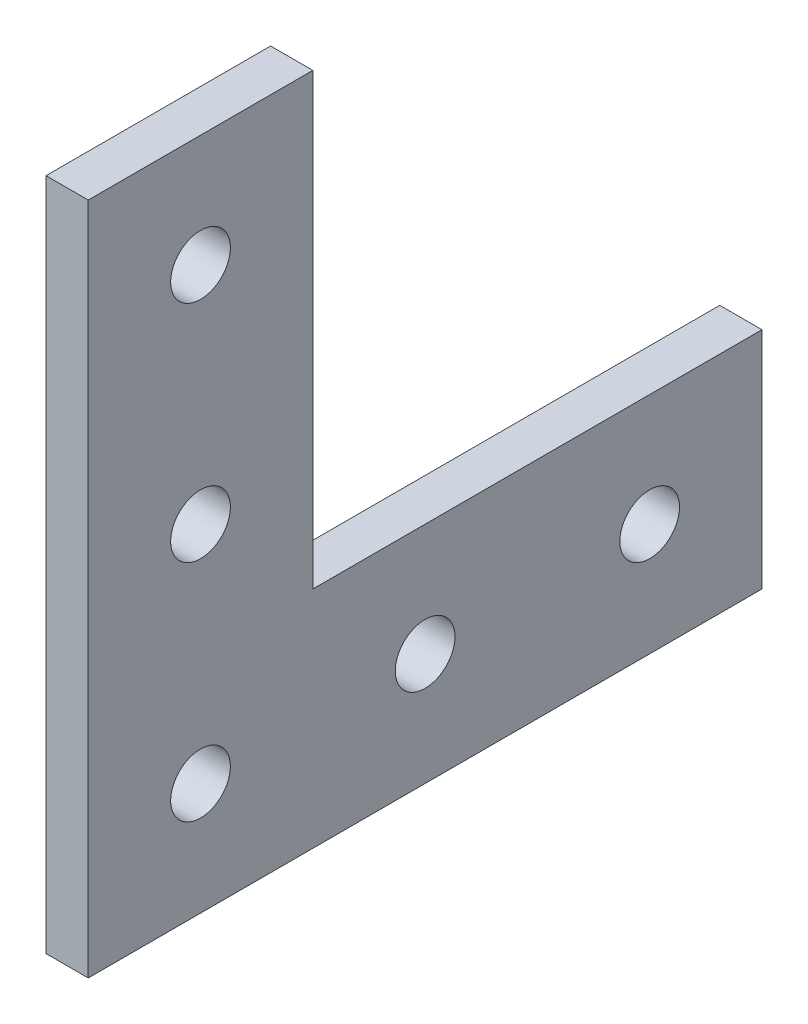
from build123d import *

# Parameters (mm, degrees)
BOSS_EXTRUDE1_DEPTH         = 4.7752
F_1_4_CLEARANCE_HOLE1_D     = 6.7564
F_1_4_CLEARANCE_HOLE1_DEPTH = 14.478
F_1_4_CLEARANCE_HOLE1_TIP   = 2.029827343


with BuildPart() as part:
    # Sketch1 → Boss-Extrude1 (new body)
    with BuildSketch(Plane(origin=(0, 0, 0), x_dir=(0, 0, -1), z_dir=(1, 0, 0))):
        Polygon((0, 0), (0, 50.8), (-25.4, 50.8), (-25.4, -25.4), (50.8, -25.4), (50.8, 0), align=None)
    extrude(amount=BOSS_EXTRUDE1_DEPTH)

    # 1/4 Clearance Hole1
    with Locations(Plane(origin=(4.7752, 0, 0), x_dir=(0, 0, -1), z_dir=(1, 0, 0))):
        with Locations((-12.7, -12.7), (12.7, -12.7), (38.1, -12.7), (-12.7, 12.7), (-12.7, 38.1)):
            Hole(F_1_4_CLEARANCE_HOLE1_D / 2, depth=F_1_4_CLEARANCE_HOLE1_DEPTH)
            with Locations((0, 0, -(F_1_4_CLEARANCE_HOLE1_DEPTH + F_1_4_CLEARANCE_HOLE1_TIP / 2))):  # 118° drill point
                Cone(0, F_1_4_CLEARANCE_HOLE1_D / 2, F_1_4_CLEARANCE_HOLE1_TIP, mode=Mode.SUBTRACT)


solid = part.part
